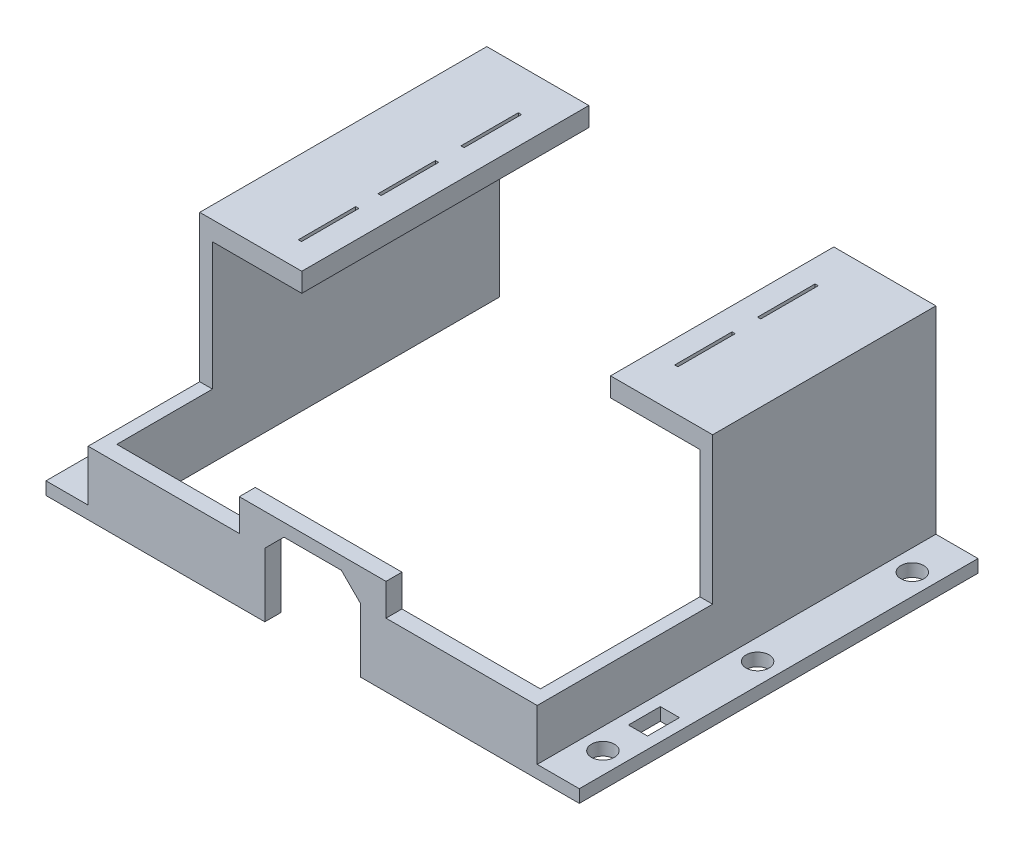
from build123d import *

# Parameters (mm, degrees)
SKETCH1_W            = 70.4
SKETCH1_H            = 2
BOSS_EXTRUDE2_DEPTH  = 10
SKETCH2_W            = 2
SKETCH2_H            = 55
BOSS_EXTRUDE3_DEPTH  = 10
SKETCH3_W            = 19
SKETCH3_H            = 3
BOSS_EXTRUDE4_DEPTH  = 2
SKETCH4_W            = 15
SKETCH4_H            = 10
CUT_EXTRUDE2_DEPTH   = 2
SKETCH5_W            = 2
SKETCH5_H            = 3
BOSS_EXTRUDE5_DEPTH  = 1
SKETCH6_W            = 2
SKETCH6_H            = 3
BOSS_EXTRUDE6_DEPTH  = 1
SKETCH7_W            = 57
SKETCH7_H            = 2
BOSS_EXTRUDE7_DEPTH  = 6.6
SKETCH8_W            = 57
SKETCH8_H            = 2
BOSS_EXTRUDE8_DEPTH  = 6.6
BOSS_EXTRUDE9_DEPTH  = 5
SKETCH12_W           = 2
SKETCH12_H           = 5
SKETCH12_H_2         = 40
SKETCH12_H_3         = 30
BOSS_EXTRUDE10_DEPTH = 20
BOSS_EXTRUDE11_DEPTH = 3
SKETCH14_W           = 0.5
SKETCH14_H           = 9
CUT_EXTRUDE3_DEPTH   = 3
SKETCH15_W           = 38.4
SKETCH15_H           = 45
CUT_EXTRUDE4_DEPTH   = 3
BOSS_EXTRUDE12_DEPTH = 0.5
SKETCH17_R           = 1.8
SKETCH17_W           = 3
SKETCH17_H           = 5
CUT_EXTRUDE6_DEPTH   = 3
SKETCH18_W           = 2.5
SKETCH18_H           = 3
BOSS_EXTRUDE13_DEPTH = 1
SKETCH19_W           = 2.5
SKETCH19_H           = 3
BOSS_EXTRUDE14_DEPTH = 1
SKETCH20_W           = 23
SKETCH20_H           = 2.5
BOSS_EXTRUDE15_DEPTH = 2
CUT_EXTRUDE8_DEPTH   = 3


with BuildPart() as part:
    # Sketch1 → Boss-Extrude2 (new body)
    with BuildSketch(Plane(origin=(0, 0, 0), x_dir=(1, 0, 0), z_dir=(0, 1, 0))):
        with Locations((35.2, 1)):
            Rectangle(SKETCH1_W, SKETCH1_H)
    extrude(amount=BOSS_EXTRUDE2_DEPTH)

    # Sketch2 → Boss-Extrude3 (add)
    with BuildSketch(Plane(origin=(0, 10, 0), x_dir=(1, 0, 0), z_dir=(0, 1, 0))):
        with Locations((1, 29.5)):
            Rectangle(SKETCH2_W, SKETCH2_H)
        with Locations((69.4, 29.5)):
            Rectangle(SKETCH2_W, SKETCH2_H)
    extrude(amount=-BOSS_EXTRUDE3_DEPTH)

    # Sketch3 → Boss-Extrude4 (add)
    with BuildSketch(Plane.XY):
        with Locations((35.2, 11.5)):
            Rectangle(SKETCH3_W, SKETCH3_H)
    extrude(amount=-BOSS_EXTRUDE4_DEPTH)

    # Sketch4 → Cut-Extrude2 (cut)
    with BuildSketch(Plane.XY):
        with Locations((35.2, 5)):
            Rectangle(SKETCH4_W, SKETCH4_H)
    extrude(amount=-CUT_EXTRUDE2_DEPTH, mode=Mode.SUBTRACT)

    # Sketch5 → Boss-Extrude5 (add)
    with BuildSketch(Plane.ZY.offset(-25.7)):
        with Locations((-1, 11.5)):
            Rectangle(SKETCH5_W, SKETCH5_H)
    extrude(amount=BOSS_EXTRUDE5_DEPTH)

    # Sketch6 → Boss-Extrude6 (add)
    with BuildSketch(Plane(origin=(44.7, 0, 0), x_dir=(0, 0, -1), z_dir=(1, 0, 0))):
        with Locations((1, 11.5)):
            Rectangle(SKETCH6_W, SKETCH6_H)
    extrude(amount=BOSS_EXTRUDE6_DEPTH)

    # Sketch7 → Boss-Extrude7 (add)
    with BuildSketch(Plane.ZY):
        with Locations((-28.5, 1)):
            Rectangle(SKETCH7_W, SKETCH7_H)
    extrude(amount=BOSS_EXTRUDE7_DEPTH)

    # Sketch8 → Boss-Extrude8 (add)
    with BuildSketch(Plane(origin=(70.4, 0, 0), x_dir=(0, 0, -1), z_dir=(1, 0, 0))):
        with Locations((28.5, 1)):
            Rectangle(SKETCH8_W, SKETCH8_H)
    extrude(amount=BOSS_EXTRUDE8_DEPTH)

    # Sketch10 → Boss-Extrude9 (add)
    with BuildSketch(Plane(origin=(0, 0, -57), x_dir=(-1, 0, 0), z_dir=(0, 0, -1))):
        Polygon((-2, 10), (-2, 0), (6.6, 0), (6.6, 2), (0, 2), (0, 10), align=None)
        Polygon((-77, 0), (-68.4, 0), (-68.4, 10), (-70.4, 10), (-70.4, 2), (-77, 2), align=None)
    extrude(amount=BOSS_EXTRUDE9_DEPTH)

    # Sketch12 → Boss-Extrude10 (add)
    with BuildSketch(Plane(origin=(0, 10, 0), x_dir=(1, 0, 0), z_dir=(0, 1, 0))):
        with Locations((1, 59.5)):
            Rectangle(SKETCH12_W, SKETCH12_H)
        with Locations((1, 37)):
            Rectangle(SKETCH12_W, SKETCH12_H_2)
        with Locations((69.4, 42)):
            Rectangle(SKETCH12_W, SKETCH12_H_3)
        with Locations((69.4, 59.5)):
            Rectangle(SKETCH12_W, SKETCH12_H)
    extrude(amount=BOSS_EXTRUDE10_DEPTH)

    # Sketch13 → Boss-Extrude11 (add)
    with BuildSketch(Plane(origin=(0, 30, 0), x_dir=(1, 0, 0), z_dir=(0, 1, 0))):
        Polygon((0, 17), (35.2, 17), (35.2, 27), (70.4, 27), (70.4, 62), (0, 62), align=None)
    extrude(amount=BOSS_EXTRUDE11_DEPTH)

    # Sketch14 → Cut-Extrude3 (cut)
    with BuildSketch(Plane(origin=(0, 33, 0), x_dir=(1, 0, 0), z_dir=(0, 1, 0))):
        with Locations((11.7, 51)):
            Rectangle(SKETCH14_W, SKETCH14_H)
        with Locations((11.7, 38)):
            Rectangle(SKETCH14_W, SKETCH14_H)
        with Locations((11.7, 25.5)):
            Rectangle(SKETCH14_W, SKETCH14_H)
        with Locations((58.2, 51)):
            Rectangle(SKETCH14_W, SKETCH14_H)
        with Locations((58.2, 38)):
            Rectangle(SKETCH14_W, SKETCH14_H)
    extrude(amount=-CUT_EXTRUDE3_DEPTH, mode=Mode.SUBTRACT)

    # Sketch15 → Cut-Extrude4 (cut)
    with BuildSketch(Plane(origin=(0, 33, 0), x_dir=(1, 0, 0), z_dir=(0, 1, 0))):
        with Locations((35.2, 39.5)):
            Rectangle(SKETCH15_W, SKETCH15_H)
    extrude(amount=-CUT_EXTRUDE4_DEPTH, mode=Mode.SUBTRACT)

    # Sketch16 → Boss-Extrude12 (add)
    with BuildSketch(Plane.XY):
        Polygon((-6.6, 0), (27.7, 0), (27.7, 10), (42.7, 10), (42.7, 0), (77, 0), (77, 2), (70.4, 2), (70.4, 10), (45.7, 10), (45.7, 13), (24.7, 13), (24.7, 10), (0, 10), (0, 2), (-6.6, 2), align=None)
    extrude(amount=BOSS_EXTRUDE12_DEPTH)

    # Sketch17 → Cut-Extrude6 (cut)
    with BuildSketch(Plane(origin=(0, 2, 0), x_dir=(1, 0, 0), z_dir=(0, 1, 0))):
        with Locations(Location((-3.3, 55, 0), (0, 0, 270))):
            Circle(SKETCH17_R)
        with Locations(Location((73.7, 55, 0), (0, 0, 270))):
            Circle(SKETCH17_R)
        with Locations(Location((-3.3, 6.5, 0), (0, 0, 270))):
            Circle(SKETCH17_R)
        with Locations(Location((73.7, 6.5, 0), (0, 0, 270))):
            Circle(SKETCH17_R)
        with Locations(Location((-3.3, 30.75, 0), (0, 0, 270))):
            Circle(SKETCH17_R)
        with Locations(Location((73.7, 30.75, 0), (0, 0, 270))):
            Circle(SKETCH17_R)
        with Locations((-3.3, 14.5)):
            Rectangle(SKETCH17_W, SKETCH17_H)
        with Locations((73.7, 14.5)):
            Rectangle(SKETCH17_W, SKETCH17_H)
    extrude(amount=-CUT_EXTRUDE6_DEPTH, mode=Mode.SUBTRACT)

    # Sketch18 → Boss-Extrude13 (add)
    with BuildSketch(Plane.ZY.offset(-24.7)):
        with Locations((-0.75, 11.5)):
            Rectangle(SKETCH18_W, SKETCH18_H)
    extrude(amount=BOSS_EXTRUDE13_DEPTH)

    # Sketch19 → Boss-Extrude14 (add)
    with BuildSketch(Plane(origin=(45.7, 0, 0), x_dir=(0, 0, -1), z_dir=(1, 0, 0))):
        with Locations((0.75, 11.5)):
            Rectangle(SKETCH19_W, SKETCH19_H)
    extrude(amount=BOSS_EXTRUDE14_DEPTH)

    # Sketch20 → Boss-Extrude15 (add)
    with BuildSketch(Plane(origin=(0, 13, 0), x_dir=(1, 0, 0), z_dir=(0, 1, 0))):
        with Locations((35.2, 0.75)):
            Rectangle(SKETCH20_W, SKETCH20_H)
    extrude(amount=BOSS_EXTRUDE15_DEPTH)

    # Sketch21 → Cut-Extrude8 (cut)
    with BuildSketch(Plane.XY.offset(0.5)):
        Polygon((27.7, 10), (30.7, 13), (39.7, 13), (42.7, 10), align=None)
    extrude(amount=-CUT_EXTRUDE8_DEPTH, mode=Mode.SUBTRACT)


solid = part.part
